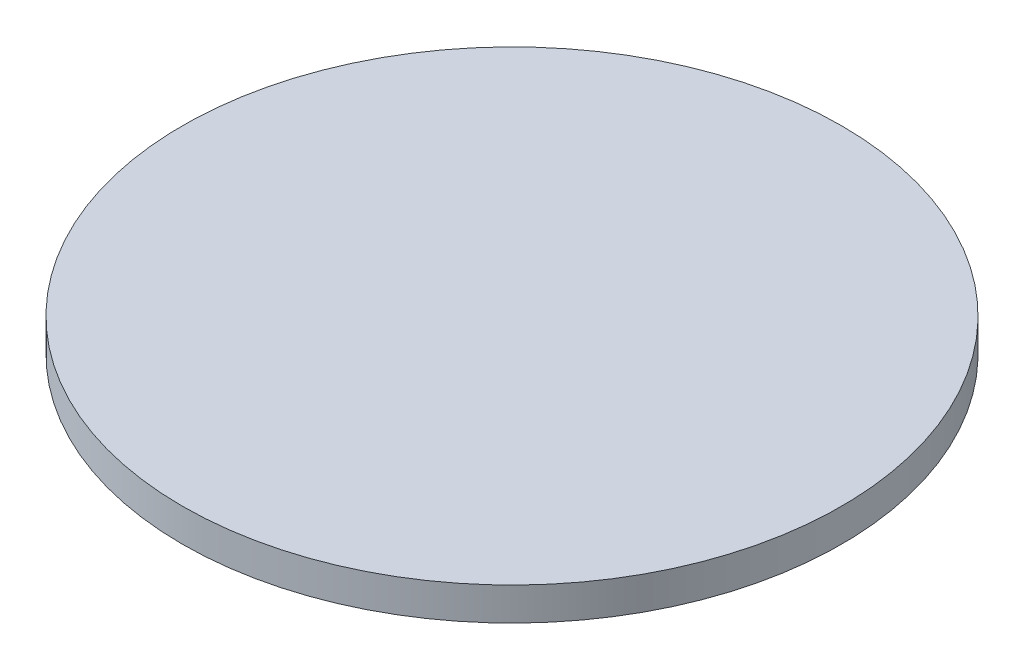
from build123d import *

# Parameters (mm, degrees)
SKETCH1_R           = 50.8
BOSS_EXTRUDE1_DEPTH = 5.08


with BuildPart() as part:
    # Sketch1 → Boss-Extrude1 (new body)
    with BuildSketch(Plane(origin=(0, 0, 0), x_dir=(1, 0, 0), z_dir=(0, 1, 0))):
        with Locations(Location((0, 0, 0), (0, 0, 270))):
            Circle(SKETCH1_R)
    extrude(amount=BOSS_EXTRUDE1_DEPTH)


solid = part.part
